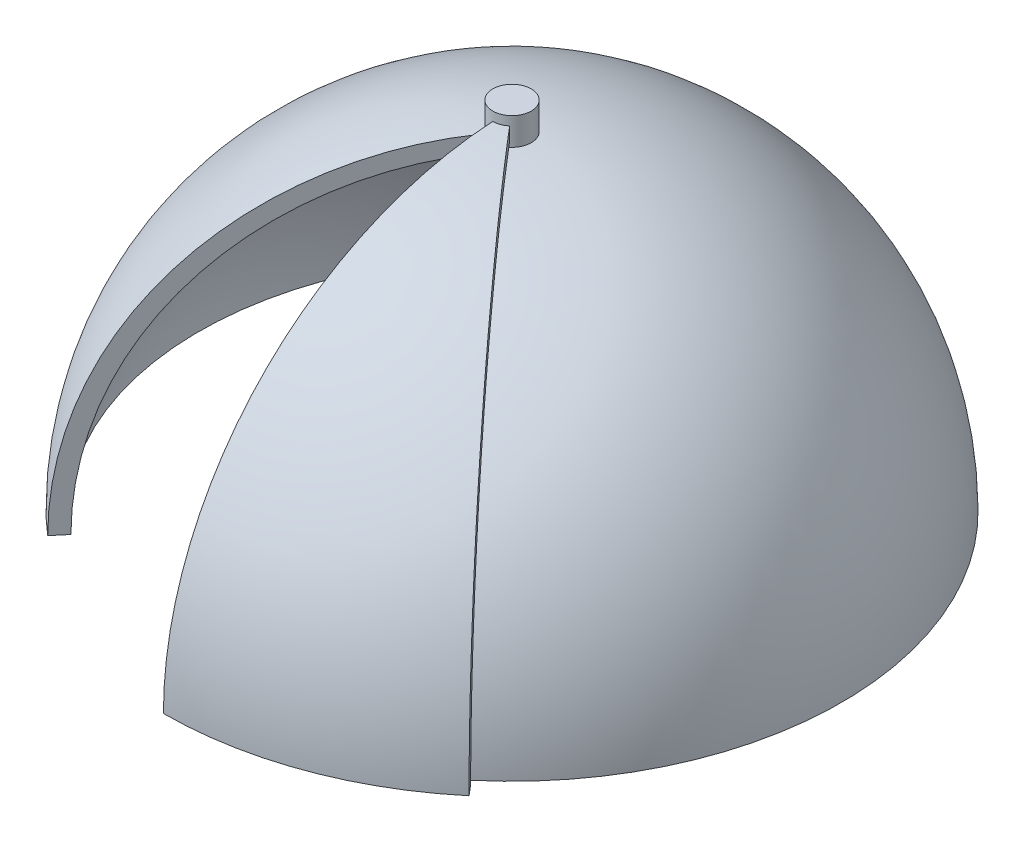
from build123d import *

# Parameters (mm, degrees)
REVOLVE1_ANGLE      = 320
REVOLVE2_ANGLE      = 40
SKETCH3_R           = 700
BOSS_EXTRUDE1_DEPTH = 1000


with BuildPart() as part:
    # Sketch1 → Revolve1 (revolve)
    with BuildSketch(Plane(origin=(0, 0, 0), x_dir=(0, 0, -1), z_dir=(1, 0, 0))):
        with BuildLine():
            Line((0, 11400), (0, 12000))
            ThreePointArc((0, 12000), (-8485.281374239, 8485.281374239), (-12000, 0))
            Line((-12000, 0), (-11400, 0))
            ThreePointArc((-11400, 0), (-8061.017305527, 8061.017305527), (0, 11400))
        make_face()
    revolve(axis=Axis((0, 11400, 0), (0, 1, 0)), revolution_arc=REVOLVE1_ANGLE)


with BuildPart() as body_2:
    # Sketch2 → Revolve2 (revolve)
    with BuildSketch(Plane(origin=(0, 0, 0), x_dir=(0, 0, -1), z_dir=(1, 0, 0))):
        with BuildLine():
            Line((-12210.978021133, 0), (-12693.141899801, 0))
            ThreePointArc((-12693.141899801, 0), (-8975.406711913, 8975.406711913), (0, 12693.141899801))
            Line((0, 12693.141899801), (0, 12210.978021133))
            ThreePointArc((0, 12210.978021133), (-8634.465363663, 8634.465363663), (-12210.978021133, 0))
        make_face()
    revolve(axis=Axis((0, 12210.978021133, 0), (0, 1, 0)), revolution_arc=REVOLVE2_ANGLE)

    # Sketch3 → Boss-Extrude1 (add)
    with BuildSketch(Plane(origin=(0, 12000, 0), x_dir=(1, 0, 0), z_dir=(0, 1, 0))):
        with Locations(Location((0, 0, 0), (0, 0, 270))):
            Circle(SKETCH3_R)
    extrude(amount=BOSS_EXTRUDE1_DEPTH)


solid = Compound([part.part, body_2.part])
